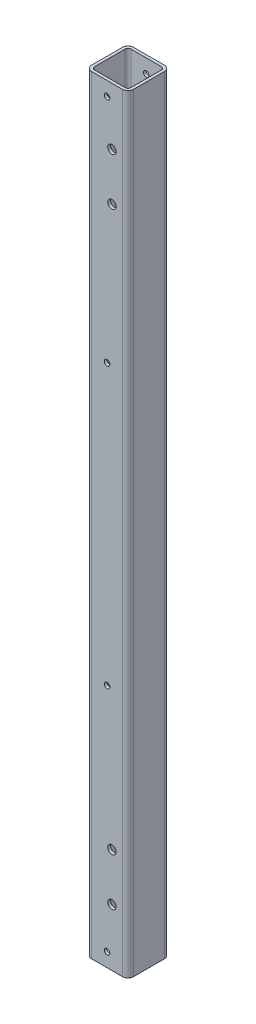
from build123d import *

# Parameters (mm, degrees)
EXTRUDE_1_DEPTH     = 275
SKETCH_2_R          = 3
SKETCH_2_R_2        = 2
CUT_EXTRUDE_1_DEPTH = 279.25348156


with BuildPart() as part:
    # 草图1 → 凸台-拉伸1 (new, symmetric)
    with BuildSketch(Plane(origin=(0, 0, 0), x_dir=(1, 0, 0), z_dir=(0, 1, 0))):
        with BuildLine():
            Line((4, 0), (26, 0))
            ThreePointArc((26, 0), (28.828427125, 1.171572875), (30, 4))
            Line((30, 4), (30, 26))
            ThreePointArc((30, 26), (28.828427125, 28.828427125), (26, 30))
            Line((26, 30), (4, 30))
            ThreePointArc((4, 30), (1.171572875, 28.828427125), (0, 26))
            Line((0, 26), (0, 4))
            ThreePointArc((0, 4), (1.171572875, 1.171572875), (4, 0))
        make_face()
        with BuildLine():
            Line((4, 2), (26, 2))
            ThreePointArc((26, 2), (27.414213562, 2.585786438), (28, 4))
            Line((28, 4), (28, 26))
            ThreePointArc((28, 26), (27.414213562, 27.414213562), (26, 28))
            Line((26, 28), (4, 28))
            ThreePointArc((4, 28), (2.585786438, 27.414213562), (2, 26))
            Line((2, 26), (2, 4))
            ThreePointArc((2, 4), (2.585786438, 2.585786438), (4, 2))
        make_face(mode=Mode.SUBTRACT)
    extrude(amount=EXTRUDE_1_DEPTH, both=True)

    # 草图2 → 切除-拉伸1 (cut, through all)
    with BuildSketch(Plane.XY):
        with Locations((18.5, 234)):
            Circle(SKETCH_2_R)
        with Locations((18.5, 200)):
            Circle(SKETCH_2_R)
        with Locations((18.5, -200)):
            Circle(SKETCH_2_R)
        with Locations((18.5, -234)):
            Circle(SKETCH_2_R)
        with Locations((15, 265)):
            Circle(SKETCH_2_R_2)
        with Locations((15, 100)):
            Circle(SKETCH_2_R_2)
        with Locations((15, -100)):
            Circle(SKETCH_2_R_2)
        with Locations((15, -265)):
            Circle(SKETCH_2_R_2)
    extrude(amount=-CUT_EXTRUDE_1_DEPTH, mode=Mode.SUBTRACT)


solid = part.part
